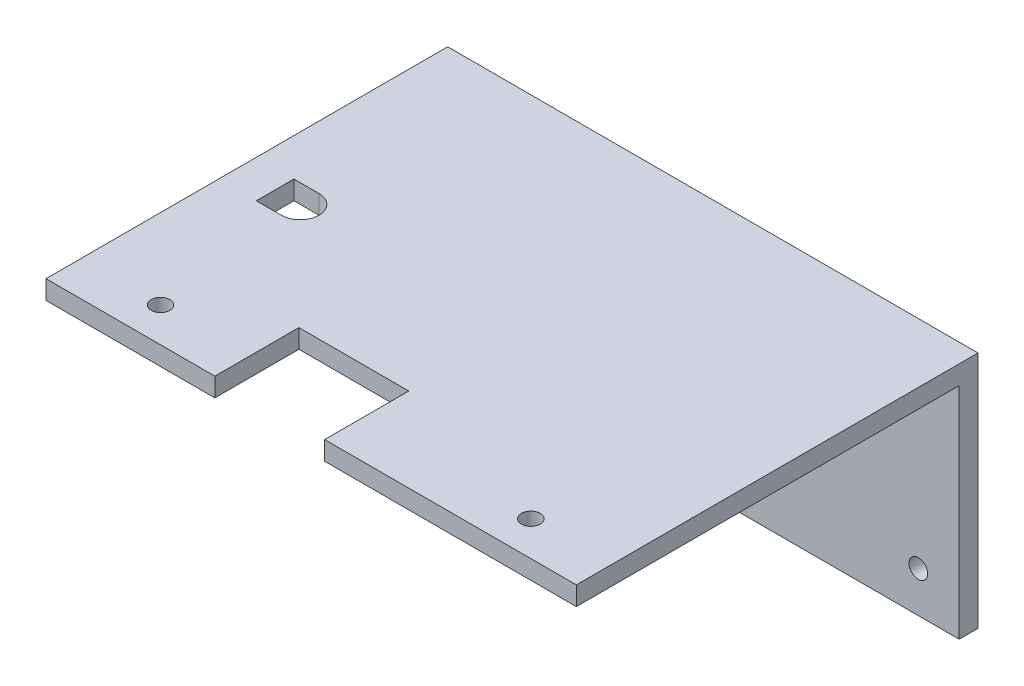
from build123d import *
from build123d.topology import SkipClean

# Parameters (mm, degrees)
SKETCH_1_R           = 1.52
EXTRUDE_2_DEPTH      = 3
SKETCH_2_W           = 84.5
SKETCH_2_H           = 3
EXTRUDE_3_DEPTH      = 58
SKETCH_3_W           = 3
SKETCH_3_H           = 32
EXTRUDE_4_DEPTH      = 58
SKETCH_5_R           = 2.1
CUT_EXTRUDE_1_DEPTH  = 58
EXTRUDE_9_DEPTH      = 5
CUT_EXTRUDE_4_DEPTH  = 4
SKETCH_15_W          = 7
SKETCH_15_H          = 7
EXTRUDE_10_DEPTH     = 7
CUT_EXTRUDE_5_DEPTH  = 5
EXTRUDE_11_DEPTH     = 84.5
CUT_EXTRUDE_START    = 84.5
SKETCH_19_R          = 1.49
CUT_EXTRUDE_6_DEPTH  = 84.5
CUT_EXTRUDE_START_2  = -84.5
SKETCH_20_R          = 1.49
CUT_EXTRUDE_7_DEPTH  = 84.5
SKETCH_21_W          = 61
SKETCH_21_H          = 35
CUT_EXTRUDE_8_DEPTH  = 84.5
SKETCH_22_W          = 34.5
SKETCH_22_H          = 10
CUT_EXTRUDE_9_DEPTH  = 1.5
CUT_EXTRUDE_10_DEPTH = 3
CUT_EXTRUDE_11_DEPTH = 3
SKETCH_27_W          = 1
SKETCH_27_H          = 6
CUT_EXTRUDE_12_DEPTH = 10
SKETCH_26_W          = 8.683127207
SKETCH_26_H          = 1.477167277
SKETCH_26_H_2        = 1.477167278
CUT_EXTRUDE_13_DEPTH = 1


with BuildPart() as part:
    # 草图1 → 凸台-拉伸2 (new body)
    with BuildSketch(Plane.XY):
        Polygon((0, 0), (42.25, 0), (42.25, 35), (0, 35), (-42.25, 35), (-42.25, 0), align=None)
        with Locations((-29.5, 17)):
            Circle(SKETCH_1_R, mode=Mode.SUBTRACT)
        with Locations((29.5, 17)):
            Circle(SKETCH_1_R, mode=Mode.SUBTRACT)
    extrude(amount=EXTRUDE_2_DEPTH)

    # 草图2 → 凸台-拉伸3 (add)
    with BuildSketch(Plane(origin=(0, 0, 0), x_dir=(-1, 0, 0), z_dir=(0, 0, -1))):
        with Locations((0, 1.5)):
            Rectangle(SKETCH_2_W, SKETCH_2_H)
    extrude(amount=EXTRUDE_3_DEPTH)

    # 草图3 → 凸台-拉伸4 (add)
    with BuildSketch(Plane(origin=(0, 0, 0), x_dir=(-1, 0, 0), z_dir=(0, 0, -1))):
        with Locations((40.75, 19)):
            Rectangle(SKETCH_3_W, SKETCH_3_H)
        with Locations((-40.75, 19)):
            Rectangle(SKETCH_3_W, SKETCH_3_H)
    extrude(amount=EXTRUDE_4_DEPTH)

    # 草图5 → 切除-拉伸1 (cut)
    with BuildSketch(Plane(origin=(42.25, 0, 0), x_dir=(0, 0, -1), z_dir=(1, 0, 0))):
        with Locations((16, 17)):
            Circle(SKETCH_5_R)
    extrude(amount=-CUT_EXTRUDE_1_DEPTH, mode=Mode.SUBTRACT)

    # 草图12 → 凸台-拉伸9 (add)
    with BuildSketch(Plane(origin=(0, 0, 0), x_dir=(-1, 0, 0), z_dir=(0, 0, -1))):
        Polygon((-35, 28), (-35, 35), (-24, 35), (-24, 28), (-29.5, 28), align=None)
        Polygon((29.5, 28), (24, 28), (24, 35), (35, 35), (35, 28), align=None)
    extrude(amount=EXTRUDE_9_DEPTH)

    # 草图14 → 切除-拉伸4 (cut)
    with BuildSketch(Plane(origin=(0, 35, 0), x_dir=(1, 0, 0), z_dir=(0, 1, 0))):
        with BuildLine():
            ThreePointArc((-28.01, 2.5), (-29.184567453, 3.956228797), (-30.856446051, 3.116566387))
            Line((-30.856446051, 3.116566387), (-28.143553949, 1.883433613))
            ThreePointArc((-28.143553949, 1.883433613), (-28.043771203, 2.184567453), (-28.01, 2.5))
        make_face()
        with BuildLine():
            Line((-28.143553949, 1.883433613), (-30.856446051, 3.116566387))
            ThreePointArc((-30.856446051, 3.116566387), (-30.116566387, 1.143553949), (-28.143553949, 1.883433613))
        make_face()
        with BuildLine():
            ThreePointArc((30.99, 2.5), (29.815432547, 3.956228797), (28.143553949, 3.116566387))
            Line((28.143553949, 3.116566387), (30.856446051, 1.883433613))
            ThreePointArc((30.856446051, 1.883433613), (30.956228797, 2.184567453), (30.99, 2.5))
        make_face()
        with BuildLine():
            Line((30.856446051, 1.883433613), (28.143553949, 3.116566387))
            ThreePointArc((28.143553949, 3.116566387), (28.883433613, 1.143553949), (30.856446051, 1.883433613))
        make_face()
    extrude(amount=-CUT_EXTRUDE_4_DEPTH, mode=Mode.SUBTRACT)

    # 草图15 → 凸台-拉伸10 (add)
    with BuildSketch(Plane(origin=(0, 3, 0), x_dir=(1, 0, 0), z_dir=(0, 1, 0))):
        with Locations((35.75, 54.5)):
            Rectangle(SKETCH_15_W, SKETCH_15_H)
        with Locations((-35.75, 54.5)):
            Rectangle(SKETCH_15_W, SKETCH_15_H)
    extrude(amount=EXTRUDE_10_DEPTH)

    # 草图16 → 切除-拉伸5 (cut)
    with BuildSketch(Plane(origin=(0, 0, -58), x_dir=(-1, 0, 0), z_dir=(0, 0, -1))):
        with BuildLine():
            ThreePointArc((-34.26, 6.5), (-35.179801686, 7.876580503), (-36.803589104, 7.553589104))
            Line((-36.803589104, 7.553589104), (-34.696410896, 5.446410896))
            ThreePointArc((-34.696410896, 5.446410896), (-34.373419497, 5.929801686), (-34.26, 6.5))
        make_face()
        with BuildLine():
            Line((-34.696410896, 5.446410896), (-36.803589104, 7.553589104))
            ThreePointArc((-36.803589104, 7.553589104), (-36.803589104, 5.446410896), (-34.696410896, 5.446410896))
        make_face()
        with BuildLine():
            ThreePointArc((36.803589104, 7.553589104), (34.696410896, 7.553589104), (34.696410896, 5.446410896))
            Line((34.696410896, 5.446410896), (36.803589104, 7.553589104))
        make_face()
        with BuildLine():
            Line((36.803589104, 7.553589104), (34.696410896, 5.446410896))
            ThreePointArc((34.696410896, 5.446410896), (36.320198314, 5.123419497), (37.24, 6.5))
            ThreePointArc((37.24, 6.5), (37.126580503, 7.070198314), (36.803589104, 7.553589104))
        make_face()
    extrude(amount=-CUT_EXTRUDE_5_DEPTH, mode=Mode.SUBTRACT)

    # 草图17 → 凸台-拉伸11 (add)
    with BuildSketch(Plane(origin=(42.25, 0, 0), x_dir=(0, 0, -1), z_dir=(1, 0, 0))):
        Polygon((58, 35), (58, 0), (61, 0), (61, 38), (58, 38), (-3, 38), (-3, 35), align=None)
    extrude(amount=-EXTRUDE_11_DEPTH)

    # 草图19 → 切除-拉伸6 (cut)
    with SkipClean():  # the faces are left unmerged after this step: merging them gives an invalid solid
        with BuildSketch(Plane(origin=(0, 0, 0), x_dir=(-1, 0, 0), z_dir=(0, 0, -1)).offset(CUT_EXTRUDE_START)):
            with Locations((-35.75, 6.5)):
                Circle(SKETCH_19_R)
            with Locations((35.75, 6.5)):
                Circle(SKETCH_19_R)
        extrude(amount=-CUT_EXTRUDE_6_DEPTH, mode=Mode.SUBTRACT)

    # 草图20 → 切除-拉伸7 (cut)
    with SkipClean():  # the faces are left unmerged after this step: merging them gives an invalid solid
        with BuildSketch(Plane.XZ.offset(-28).offset(CUT_EXTRUDE_START_2)):
            with Locations(Location((-29.5, -2.5, 0), (0, 0, 270))):
                Circle(SKETCH_20_R)
            with Locations(Location((29.5, -2.5, 0), (0, 0, 270))):
                Circle(SKETCH_20_R)
        extrude(amount=CUT_EXTRUDE_7_DEPTH, mode=Mode.SUBTRACT)

    # 草图21 → 切除-拉伸8 (cut)
    with BuildSketch(Plane.ZY.offset(42.25)):
        with Locations((-27.5, 17.5)):
            Rectangle(SKETCH_21_W, SKETCH_21_H)
    extrude(amount=-CUT_EXTRUDE_8_DEPTH, mode=Mode.SUBTRACT)

    # 草图22 → 切除-拉伸9 (cut)
    with BuildSketch(Plane.XZ.offset(-35)):
        with Locations((0, -53)):
            Rectangle(SKETCH_22_W, SKETCH_22_H)
    extrude(amount=-CUT_EXTRUDE_9_DEPTH, mode=Mode.SUBTRACT)

    # 草图23 → 切除-拉伸10 (cut)
    with BuildSketch(Plane(origin=(0, 38, 0), x_dir=(1, 0, 0), z_dir=(0, 1, 0))):
        with BuildLine():
            Line((-32.25, 24.5), (-35.25, 24.5))
            Line((-35.25, 24.5), (-35.25, 27.5))
            Line((-35.25, 27.5), (-35.25, 30.5))
            Line((-35.25, 30.5), (-32.25, 30.5))
            ThreePointArc((-32.25, 30.5), (-29.25, 27.5), (-32.25, 24.5))
        make_face()
    extrude(amount=-CUT_EXTRUDE_10_DEPTH, mode=Mode.SUBTRACT)

    # 草图24 → 切除-拉伸11 (cut)
    with BuildSketch(Plane(origin=(0, 38, 0), x_dir=(1, 0, 0), z_dir=(0, 1, 0))):
        Polygon((2.15, -3), (2.15, 10.4), (-15.35, 10.4), (-15.35, -3), (-12.699197399, -3), (-12.199197399, -3), (-1.699197399, -3), align=None)
    extrude(amount=-CUT_EXTRUDE_11_DEPTH, mode=Mode.SUBTRACT)

    # 草图27 → 切除-拉伸12 (cut)
    with BuildSketch(Plane(origin=(0, 38, 0), x_dir=(1, 0, 0), z_dir=(0, 1, 0))):
        with Locations((-35.75, 27.5)):
            Rectangle(SKETCH_27_W, SKETCH_27_H)
    extrude(amount=-CUT_EXTRUDE_12_DEPTH, mode=Mode.SUBTRACT)

    # 草图26 → 切除-拉伸13 (cut)
    # profile 1 of 9: a face of its own
    with BuildSketch(Plane(origin=(0, 0, -61), x_dir=(-1, 0, 0), z_dir=(0, 0, -1))):
        with BuildLine():
            Line((-24.160270124, 21.995809621), (-24.160270124, 18.425534467))
            Line((-24.160270124, 18.425534467), (-12.680881613, 18.425534467))
            Line((-12.680881613, 18.425534467), (-11.724265904, 19.382150176))
            Line((-11.724265904, 19.382150176), (-10.326135252, 17.984019524))
            Line((-10.326135252, 17.984019524), (-14.226183913, 17.984019524))
            Line((-14.226183913, 17.984019524), (-13.269568203, 17.248161286))
            add(Edge.make_bspline(
                [(-13.269568203, 17.248161286), (-13.379027332, 17.209369794), (-13.596665008, 17.132240637), (-13.915197945, 16.995553485), (-14.222085774, 16.835916879), (-14.476059594, 16.689989672), (-14.683649855, 16.554382392), (-14.858077056, 16.434366022), (-15.050535543, 16.294785422), (-15.263725048, 16.140549276), (-15.492584267, 15.964754759), (-15.740770406, 15.771458002), (-16.006974396, 15.558655054), (-16.191204175, 15.411248091), (-16.286586979, 15.334929868)],
                knots=[0, 0, 0, 0, 1.162989737, 2.312373436, 3.468114612, 4.626110198, 5.24445396, 5.951151674, 6.746590043, 7.625640194, 8.586542864, 9.636780879, 10.776471069, 12, 12, 12, 12], degree=3))
            add(Edge.make_bspline(
                [(-16.286586979, 15.334929868), (-16.197151874, 15.274208687), (-16.014644176, 15.150296685), (-15.724632123, 14.974581485), (-15.410838022, 14.810775679), (-15.077660251, 14.64781088), (-14.721220459, 14.497095385), (-14.343031309, 14.351802315), (-13.943488451, 14.214331806), (-13.388869683, 14.036648471), (-12.689222869, 13.850898979), (-11.85710786, 13.689369841), (-11.047179402, 13.589306553), (-10.514454291, 13.57560582), (-10.252549428, 13.568870097)],
                knots=[0, 0, 0, 0, 0.611010418, 1.246871733, 1.915364327, 2.611282961, 3.342891768, 4.102025923, 4.90105097, 5.730948828, 7.393839832, 8.989131719, 10.519759946, 12, 12, 12, 12], degree=3))
            Line((-10.252549428, 13.568870097), (-10.252549428, 13.274526802))
            add(Edge.make_bspline(
                [(-10.252549428, 13.274526802), (-10.34657537, 13.2544835), (-10.52578858, 13.216281017), (-10.777041509, 13.133548249), (-10.998941308, 13.034712148), (-11.190400303, 12.912864051), (-11.352373959, 12.773622454), (-11.486525492, 12.61694506), (-11.586706503, 12.438471321), (-11.629148565, 12.309668786), (-11.65068008, 12.244325269)],
                knots=[0, 0, 0, 0, 1.255284546, 2.392569207, 3.449534634, 4.420859121, 5.346510379, 6.230990395, 7.102554087, 8, 8, 8, 8], degree=3))
            add(Edge.make_bspline(
                [(-11.65068008, 12.244325269), (-11.822789276, 12.283602514), (-12.167080606, 12.362173649), (-12.678225983, 12.509507779), (-13.188934204, 12.673286475), (-13.694305529, 12.869609543), (-14.200888823, 13.081348205), (-14.703514872, 13.318220227), (-15.203939479, 13.57910278), (-15.704196457, 13.859472048), (-16.197678133, 14.181192886), (-16.670438244, 14.561686751), (-17.128330747, 14.995970149), (-17.569461211, 15.484201867), (-17.992593792, 16.030446075), (-18.399477087, 16.630330395), (-18.794927657, 17.28326736), (-19.033803799, 17.746310202), (-19.156434107, 17.984019524)],
                knots=[0, 0, 0, 0, 0.861892958, 1.724151182, 2.596755242, 3.479973936, 4.370648144, 5.27758037, 6.192291257, 7.126070541, 8.077182181, 9.065156301, 10.08504478, 11.156061535, 12.275074646, 13.456322362, 14.694168589, 16, 16, 16, 16], degree=3))
            Line((-19.156434107, 17.984019524), (-21.069665525, 17.984019524))
            Line((-21.069665525, 17.984019524), (-21.069665525, 13.623378114))
            Line((-21.069665525, 13.623378114), (-17.390374336, 14.585444626))
            Line((-17.390374336, 14.585444626), (-17.316788512, 14.364687154))
            add(Edge.make_bspline(
                [(-17.316788512, 14.364687154), (-17.45772383, 14.301364875), (-17.732876029, 14.177738914), (-18.13348163, 13.992297401), (-18.512439288, 13.812634926), (-18.870147572, 13.637687994), (-19.206242779, 13.469525315), (-19.522395551, 13.308589323), (-19.814833454, 13.150378941), (-20.088641126, 13.000210705), (-20.341383729, 12.857521368), (-20.571311378, 12.717000033), (-20.780988349, 12.584485214), (-20.969514912, 12.456785951), (-21.134959988, 12.333805343), (-21.281895424, 12.220221873), (-21.403870271, 12.108022185), (-21.476926727, 12.033826892), (-21.511180468, 11.999039189)],
                knots=[0, 0, 0, 0, 1.533553566, 2.994002063, 4.381478458, 5.696137863, 6.946221177, 8.111684215, 9.217067415, 10.246152141, 11.211350723, 12.097452041, 12.920423487, 13.673221831, 14.356732153, 14.966497679, 15.51542516, 16, 16, 16, 16], degree=3))
            Line((-21.511180468, 11.999039189), (-22.32062453, 13.181863172))
            add(Edge.make_bspline(
                [(-22.32062453, 13.181863172), (-22.297072958, 13.202885592), (-22.248239096, 13.246475294), (-22.18824227, 13.331195768), (-22.136013315, 13.432726717), (-22.096724402, 13.554532436), (-22.06343145, 13.693786683), (-22.043585697, 13.851867027), (-22.029493323, 14.027392321), (-22.027387403, 14.150254669), (-22.026281234, 14.214790106)],
                knots=[0, 0, 0, 0, 0.682693637, 1.415555963, 2.234920952, 3.150681089, 4.182789996, 5.336176214, 6.600783439, 8, 8, 8, 8], degree=3))
            Line((-22.026281234, 14.214790106), (-22.026281234, 17.984019524))
            Line((-22.026281234, 17.984019524), (-24.160270124, 17.984019524))
            add(Edge.make_bspline(
                [(-24.160270124, 17.984019524), (-24.168125469, 17.786820008), (-24.18341644, 17.40295756), (-24.225995993, 16.845483091), (-24.28909383, 16.322812005), (-24.36771653, 15.834473788), (-24.461258923, 15.378984353), (-24.575892362, 14.958706334), (-24.706030394, 14.573318562), (-24.854644006, 14.217160973), (-25.030991723, 13.882708525), (-25.228774831, 13.555763946), (-25.457464537, 13.235029228), (-25.714546505, 12.918677558), (-26.000641454, 12.605065239), (-26.317753786, 12.298121792), (-26.661021037, 11.994556213), (-26.905567736, 11.802507686), (-27.030117252, 11.704695894)],
                knots=[0, 0, 0, 0, 1.314456064, 2.558679314, 3.722765753, 4.820013758, 5.852481819, 6.818366769, 7.719637783, 8.560266732, 9.385732132, 10.235652473, 11.10366755, 12.007109401, 12.949392841, 13.929296627, 14.94537484, 16, 16, 16, 16], degree=3))
            Line((-27.030117252, 11.704695894), (-27.250874723, 11.925453366))
            add(Edge.make_bspline(
                [(-27.250874723, 11.925453366), (-27.144030867, 12.030338658), (-26.932379786, 12.238109945), (-26.643447224, 12.57143052), (-26.383166481, 12.919457311), (-26.151098684, 13.280287452), (-25.952522548, 13.657483066), (-25.77576383, 14.04470512), (-25.631915178, 14.447970951), (-25.480240864, 15.009127767), (-25.33606624, 15.739335242), (-25.206759093, 16.649043681), (-25.131118944, 17.600205793), (-25.111825957, 18.59535819), (-25.1222814, 19.63927197), (-25.134968278, 20.739454035), (-25.15623546, 21.899633602), (-25.178860218, 22.692621218), (-25.190471657, 23.099596978)],
                knots=[0, 0, 0, 0, 0.612753261, 1.213826364, 1.803679967, 2.390712863, 2.968052278, 3.54732904, 4.131989122, 4.718479832, 5.92561504, 7.176358299, 8.478503378, 9.828960425, 11.249685427, 12.752326763, 14.333234648, 16, 16, 16, 16], degree=3))
            Line((-25.190471657, 23.099596978), (-23.939512653, 22.437324564))
            Line((-23.939512653, 22.437324564), (-13.343154027, 22.437324564))
            Line((-13.343154027, 22.437324564), (-12.460124142, 23.32035445))
            Line((-12.460124142, 23.32035445), (-11.135579313, 21.995809621))
            Line((-11.135579313, 21.995809621), (-24.160270124, 21.995809621))
        make_face()
        with BuildLine():
            add(Edge.make_bspline(
                [(-18.714919164, 17.984019524), (-18.629800887, 17.852388691), (-18.463350906, 17.594982758), (-18.198748129, 17.230394042), (-17.939824425, 16.884933279), (-17.672240606, 16.570027342), (-17.403650909, 16.279402591), (-17.13532419, 16.011956537), (-16.862384998, 15.770524293), (-16.673549422, 15.626384379), (-16.580930274, 15.555687339)],
                knots=[0, 0, 0, 0, 1.157122963, 2.262770124, 3.325256553, 4.343813707, 5.312101841, 6.246458264, 7.139931436, 8, 8, 8, 8], degree=3))
            add(Edge.make_bspline(
                [(-16.580930274, 15.555687339), (-16.479859653, 15.66994998), (-16.281905757, 15.893741369), (-15.99552218, 16.225353342), (-15.729494482, 16.546980047), (-15.479117259, 16.854988538), (-15.252032181, 17.15519431), (-15.039148932, 17.440481364), (-14.843317304, 17.713407529), (-14.7251781, 17.895449256), (-14.667698855, 17.984019524)],
                knots=[0, 0, 0, 0, 1.183140506, 2.317263606, 3.398018913, 4.420277862, 5.395463474, 6.317073486, 7.181191834, 8, 8, 8, 8], degree=3))
            Line((-14.667698855, 17.984019524), (-18.714919164, 17.984019524))
        make_face(mode=Mode.SUBTRACT)
    # profile 2 of 9: a face of its own
    with BuildSketch(Plane(origin=(0, 0, -61), x_dir=(-1, 0, 0), z_dir=(0, 0, -1))):
        with BuildLine():
            Line((-23.277240239, 20.518642344), (-14.888456327, 20.518642344))
            Line((-14.888456327, 20.518642344), (-14.079012265, 21.328086405))
            Line((-14.079012265, 21.328086405), (-12.828053261, 20.077127401))
            Line((-12.828053261, 20.077127401), (-20.848908054, 20.077127401))
            add(Edge.make_bspline(
                [(-20.848908054, 20.077127401), (-21.023427242, 20.074769381), (-21.354826742, 20.070291668), (-21.824906807, 20.030300409), (-22.24134465, 19.962778759), (-22.495569603, 19.890374847), (-22.614967825, 19.85636993)],
                knots=[0, 0, 0, 0, 1.172045317, 2.22563053, 3.166657104, 4, 4, 4, 4], degree=3))
            Line((-22.614967825, 19.85636993), (-23.277240239, 20.518642344))
        make_face()
    # profile 3 of 9: a face of its own
    with BuildSketch(Plane(origin=(0, 0, -61), x_dir=(-1, 0, 0), z_dir=(0, 0, -1))):
        with BuildLine():
            add(Edge.make_bspline(
                [(-23.865926829, 23.031461956), (-23.845291812, 23.497427428), (-23.803995333, 24.429955543), (-23.786395113, 25.837721456), (-23.804610344, 27.264521037), (-23.845329615, 28.223425163), (-23.865926829, 28.708471992)],
                knots=[0, 0, 0, 0, 0.985459739, 1.972182419, 2.974259824, 4, 4, 4, 4], degree=3))
            Line((-23.865926829, 28.708471992), (-22.762139472, 28.193371225))
            Line((-22.762139472, 28.193371225), (-14.299769736, 28.193371225))
            Line((-14.299769736, 28.193371225), (-13.637497322, 28.972835877))
            Line((-13.637497322, 28.972835877), (-12.460124142, 28.005318564))
            Line((-12.460124142, 28.005318564), (-13.195982379, 27.484766996))
            add(Edge.make_bspline(
                [(-13.195982379, 27.484766996), (-13.196552469, 27.242203997), (-13.197637152, 26.780690827), (-13.190359125, 26.12297442), (-13.186012185, 25.53517872), (-13.178427759, 25.017317055), (-13.166172803, 24.569499049), (-13.15794357, 24.191392115), (-13.140867137, 23.882560256), (-13.12802282, 23.700080927), (-13.122396556, 23.620148546)],
                knots=[0, 0, 0, 0, 1.505804279, 2.865022734, 4.083253695, 5.154933375, 6.080121932, 6.864367033, 7.502552716, 8, 8, 8, 8], degree=3))
            Line((-13.122396556, 23.620148546), (-14.152598089, 23.178633604))
            Line((-14.152598089, 23.178633604), (-14.152598089, 23.914491842))
            Line((-14.152598089, 23.914491842), (-22.835725296, 23.914491842))
            Line((-22.835725296, 23.914491842), (-22.835725296, 23.472976899))
            Line((-22.835725296, 23.472976899), (-23.865926829, 23.031461956))
        make_face()
        with Locations((-18.494161693, 27.013272644)):
            Rectangle(SKETCH_26_W, SKETCH_26_H, mode=Mode.SUBTRACT)
        with Locations((-18.494161693, 25.094590423)):
            Rectangle(SKETCH_26_W, SKETCH_26_H_2, mode=Mode.SUBTRACT)
    # profile 4 of 9: a face of its own
    with BuildSketch(Plane(origin=(0, 0, -61), x_dir=(-1, 0, 0), z_dir=(0, 0, -1))):
        with BuildLine():
            Line((-3.11472452, 26.100263348), (5.936331806, 26.100263348))
            Line((5.936331806, 26.100263348), (6.819361692, 26.983293234))
            Line((6.819361692, 26.983293234), (8.070320696, 25.658748406))
            Line((8.070320696, 25.658748406), (2.698555559, 25.658748406))
            Line((2.698555559, 25.658748406), (2.698555559, 14.064893057))
            Line((2.698555559, 14.064893057), (6.525018396, 14.064893057))
            Line((6.525018396, 14.064893057), (7.555219929, 15.09509459))
            Line((7.555219929, 15.09509459), (8.953350582, 13.623378114))
            Line((8.953350582, 13.623378114), (-2.52603793, 13.623378114))
            add(Edge.make_bspline(
                [(-2.52603793, 13.623378114), (-2.682383893, 13.620825327), (-2.989267799, 13.615814583), (-3.441008131, 13.574448482), (-3.874454144, 13.504533239), (-4.154394078, 13.436222822), (-4.292097701, 13.402620643)],
                knots=[0, 0, 0, 0, 1.051078301, 2.063110603, 3.047236021, 4, 4, 4, 4], degree=3))
            Line((-4.292097701, 13.402620643), (-4.954370115, 14.064893057))
            Line((-4.954370115, 14.064893057), (1.594768202, 14.064893057))
            Line((1.594768202, 14.064893057), (1.594768202, 25.658748406))
            Line((1.594768202, 25.658748406), (-0.686392335, 25.658748406))
            add(Edge.make_bspline(
                [(-0.686392335, 25.658748406), (-0.842738298, 25.656195618), (-1.149622204, 25.651184875), (-1.601362537, 25.609818773), (-2.034808549, 25.53990353), (-2.314748484, 25.471593113), (-2.452452106, 25.437990934)],
                knots=[0, 0, 0, 0, 1.051078301, 2.063110603, 3.047236021, 4, 4, 4, 4], degree=3))
            Line((-2.452452106, 25.437990934), (-3.11472452, 26.100263348))
        make_face()
    # profile 5 of 9: a face of its own
    with BuildSketch(Plane(origin=(0, 0, -61), x_dir=(-1, 0, 0), z_dir=(0, 0, -1))):
        with BuildLine():
            add(Edge.make_bspline(
                [(-2.746795401, 25.260839877), (-2.839427742, 24.968303609), (-3.019228084, 24.400487655), (-3.281770497, 23.573160017), (-3.527043669, 22.794598215), (-3.754082435, 22.064217083), (-3.972625716, 21.385363248), (-4.165610723, 20.753301375), (-4.350978515, 20.172123361), (-4.514359328, 19.638579496), (-4.670374497, 19.155992268), (-4.800873926, 18.720234098), (-4.922835497, 18.335051048), (-5.025763944, 17.998715596), (-5.111856354, 17.711027089), (-5.188487564, 17.474461926), (-5.240136864, 17.284120702), (-5.322152673, 17.016183331), (-5.404782941, 16.630321005), (-5.477784944, 16.093729016), (-5.515026362, 15.506310117), (-5.512882869, 14.991341314), (-5.497009, 14.575442518), (-5.486138402, 14.282003485), (-5.475961421, 14.013933617), (-5.463169302, 13.771269416), (-5.444603416, 13.554423358), (-5.433080067, 13.362441289), (-5.417079938, 13.195128646), (-5.402574937, 13.092792004), (-5.395885058, 13.045593128)],
                knots=[0, 0, 0, 0, 2.041568967, 3.962706699, 5.774940625, 7.472509966, 9.051465666, 10.519714011, 11.86933399, 13.110059976, 14.232164243, 15.243582626, 16.136356738, 16.920250246, 17.583717625, 18.134310754, 18.574340471, 18.895654842, 19.998366152, 21.194231333, 22.496502179, 23.910862062, 24.618455167, 25.265644129, 25.864515384, 26.403303927, 26.882176691, 27.312382891, 27.682862807, 28, 28, 28, 28], degree=3))
            add(Edge.make_bspline(
                [(-5.395885058, 13.045593128), (-5.398665305, 13.001483546), (-5.403941562, 12.917773893), (-5.485344353, 12.814119132), (-5.61297447, 12.758901961), (-5.70961306, 12.753999466), (-5.763814177, 12.751249832)],
                knots=[0, 0, 0, 0, 0.970945968, 1.84262797, 2.790007448, 4, 4, 4, 4], degree=3))
            add(Edge.make_bspline(
                [(-5.763814177, 12.751249832), (-5.815746821, 12.752578259), (-5.92676303, 12.755418032), (-6.100714255, 12.790526499), (-6.29568396, 12.832149852), (-6.498223238, 12.893744246), (-6.697020507, 12.97809308), (-6.839919706, 13.134548928), (-6.930080506, 13.333055355), (-6.937322348, 13.481479276), (-6.941187357, 13.560693894)],
                knots=[0, 0, 0, 0, 0.773098138, 1.652648856, 2.638415398, 3.7437562, 4.81590307, 5.802785575, 6.827335235, 8, 8, 8, 8], degree=3))
            add(Edge.make_bspline(
                [(-6.941187357, 13.560693894), (-6.937934221, 13.629862536), (-6.930657525, 13.784580687), (-6.886515389, 14.037950208), (-6.81305059, 14.336110537), (-6.752921142, 14.549289114), (-6.720429886, 14.664481251)],
                knots=[0, 0, 0, 0, 0.735604743, 1.64541913, 2.727690164, 4, 4, 4, 4], degree=3))
            add(Edge.make_bspline(
                [(-6.720429886, 14.664481251), (-6.687637367, 14.780506109), (-6.625708814, 14.999618637), (-6.55354849, 15.311907658), (-6.509346052, 15.5889468), (-6.502735197, 15.761781027), (-6.499672415, 15.841854432)],
                knots=[0, 0, 0, 0, 1.204024663, 2.273796248, 3.200256724, 4, 4, 4, 4], degree=3))
            add(Edge.make_bspline(
                [(-6.499672415, 15.841854432), (-6.504150102, 15.922992722), (-6.512785333, 16.079468099), (-6.570839154, 16.303273162), (-6.682009733, 16.494647268), (-6.804709832, 16.634283399), (-6.931456415, 16.729800377), (-7.050403392, 16.804574355), (-7.194660677, 16.875945376), (-7.361771866, 16.950103255), (-7.553015164, 17.023095953), (-7.768561306, 17.096352524), (-8.008530152, 17.169906593), (-8.177474069, 17.215937857), (-8.265732186, 17.239985084)],
                knots=[0, 0, 0, 0, 1.187079274, 2.289285076, 3.342195022, 4.395775184, 4.983000191, 5.657502931, 6.447674094, 7.333854754, 8.330539672, 9.439608888, 10.662424192, 12, 12, 12, 12], degree=3))
            Line((-8.265732186, 17.239985084), (-8.265732186, 17.534328379))
            add(Edge.make_bspline(
                [(-8.265732186, 17.534328379), (-8.160328969, 17.523637591), (-7.960403619, 17.503359656), (-7.676435167, 17.471289125), (-7.422778883, 17.45033409), (-7.200207631, 17.433635135), (-7.008518025, 17.422489049), (-6.848544438, 17.416357096), (-6.719530612, 17.416589775), (-6.583737884, 17.419797532), (-6.421119619, 17.473358788), (-6.241835116, 17.615378198), (-6.053701429, 17.821637831), (-5.913216166, 18.021581654), (-5.8054173, 18.199005326), (-5.735073123, 18.350406292), (-5.644554074, 18.546316004), (-5.53903957, 18.789284173), (-5.415940564, 19.077614916), (-5.280531391, 19.41359573), (-5.128076721, 19.7964816), (-4.954971702, 20.224577143), (-4.774873911, 20.703560202), (-4.572039346, 21.226037823), (-4.353169902, 21.795902685), (-4.123579225, 22.413876071), (-3.873950238, 23.077360297), (-3.610661094, 23.788182829), (-3.329128286, 24.545209147), (-3.13897058, 25.06632385), (-3.041138696, 25.334425701)],
                knots=[0, 0, 0, 0, 0.850511031, 1.613221316, 2.293981825, 2.893612504, 3.404960353, 3.835498749, 4.178273129, 4.441228577, 4.923289046, 5.518468063, 6.256366938, 7.160972486, 7.474913609, 7.921759358, 8.499387229, 9.208054695, 10.047898715, 11.01623083, 12.11591387, 13.356443752, 14.723072805, 16.223745304, 17.855846161, 19.623630231, 21.516038356, 23.546736579, 25.708895644, 28, 28, 28, 28], degree=3))
            Line((-3.041138696, 25.334425701), (-2.746795401, 25.260839877))
        make_face()
    # profile 6 of 9: a face of its own
    with BuildSketch(Plane(origin=(0, 0, -61), x_dir=(-1, 0, 0), z_dir=(0, 0, -1))):
        with BuildLine():
            add(Edge.make_bspline(
                [(-8.192146362, 24.18703193), (-7.990458264, 24.082442082), (-7.609488991, 23.884881993), (-7.085120965, 23.580048878), (-6.640249475, 23.290140937), (-6.273549219, 23.016913782), (-5.989354573, 22.755216585), (-5.780545077, 22.510701799), (-5.649105382, 22.274348234), (-5.608677547, 22.046105237), (-5.620640749, 21.843659912), (-5.637321799, 21.659369853), (-5.670886607, 21.492738895), (-5.713196869, 21.341351145), (-5.770550356, 21.206455469), (-5.841037404, 21.088821987), (-5.924399384, 20.988277214), (-6.016319304, 20.907988017), (-6.113801431, 20.852700054), (-6.217230833, 20.834503262), (-6.318251357, 20.870323124), (-6.407834703, 20.949390318), (-6.492533202, 21.06559359), (-6.573476368, 21.221191628), (-6.651138408, 21.417970077), (-6.69611105, 21.564822727), (-6.720429886, 21.644232908)],
                knots=[0, 0, 0, 0, 2.772682241, 5.237328091, 7.399302354, 9.251042932, 10.812257102, 12.104195485, 13.165469004, 14.067972364, 14.88878903, 15.635733183, 16.325068669, 16.960193367, 17.551302845, 18.108471374, 18.628074858, 19.139209544, 19.590563383, 19.982585792, 20.378819423, 20.851592597, 21.421523614, 22.125943269, 22.986608804, 24, 24, 24, 24], degree=3))
            add(Edge.make_bspline(
                [(-6.720429886, 21.644232908), (-6.754692027, 21.725633644), (-6.826331448, 21.895836131), (-6.962985711, 22.15202586), (-7.1224653, 22.423959702), (-7.312533644, 22.707458694), (-7.527781971, 23.005609368), (-7.77437751, 23.314120193), (-8.043614675, 23.640673331), (-8.238528373, 23.8570907), (-8.339318009, 23.968999859)],
                knots=[0, 0, 0, 0, 0.744234975, 1.556136334, 2.445417578, 3.401334143, 4.432387501, 5.544831445, 6.73043532, 8, 8, 8, 8], degree=3))
            Line((-8.339318009, 23.968999859), (-8.192146362, 24.18703193))
        make_face()
    # profile 7 of 9: a face of its own
    with BuildSketch(Plane(origin=(0, 0, -61), x_dir=(-1, 0, 0), z_dir=(0, 0, -1))):
        with BuildLine():
            add(Edge.make_bspline(
                [(-6.79401571, 28.100707595), (-6.632063735, 28.017611014), (-6.325809687, 27.860473909), (-5.89643433, 27.630939955), (-5.528079346, 27.412292803), (-5.216705639, 27.21241532), (-4.963703519, 27.028480115), (-4.770826681, 26.859371182), (-4.630311326, 26.708745994), (-4.531191889, 26.528379118), (-4.473434961, 26.329310248), (-4.413907563, 26.12728093), (-4.374184209, 25.96187578), (-4.368242246, 25.862388269), (-4.365683525, 25.819547058)],
                knots=[0, 0, 0, 0, 1.862745508, 3.522484708, 4.981331506, 6.244841051, 7.308391781, 8.177705717, 8.869471105, 9.402220716, 10.26654944, 10.981658618, 11.561482858, 12, 12, 12, 12], degree=3))
            add(Edge.make_bspline(
                [(-4.365683525, 25.819547058), (-4.368606295, 25.759186554), (-4.374376327, 25.640024937), (-4.427455916, 25.468042192), (-4.506316588, 25.302939384), (-4.61961111, 25.159654786), (-4.734657758, 25.034270722), (-4.842093079, 24.942096926), (-4.936558059, 24.878384517), (-5.000094781, 24.867641996), (-5.027955939, 24.862931348)],
                knots=[0, 0, 0, 0, 1.168549645, 2.306910249, 3.466110278, 4.700391274, 5.835606663, 6.761275426, 7.456813324, 8, 8, 8, 8], degree=3))
            add(Edge.make_bspline(
                [(-5.027955939, 24.862931348), (-5.046667189, 24.865119134), (-5.087261711, 24.869865589), (-5.142313682, 24.911921683), (-5.200670293, 24.968496461), (-5.252196571, 25.052750941), (-5.30917625, 25.155263506), (-5.360395728, 25.28381452), (-5.419418322, 25.432466356), (-5.45215575, 25.541251897), (-5.469470881, 25.598789586)],
                knots=[0, 0, 0, 0, 0.49729429, 1.078892339, 1.802996595, 2.682097007, 3.70758534, 4.952970961, 6.388397881, 8, 8, 8, 8], degree=3))
            add(Edge.make_bspline(
                [(-5.469470881, 25.598789586), (-5.503091639, 25.680945268), (-5.572727858, 25.851108334), (-5.699074433, 26.107896779), (-5.85095229, 26.374594396), (-6.020784695, 26.655567873), (-6.219865806, 26.944079625), (-6.437714332, 27.247513469), (-6.679046517, 27.562371405), (-6.852396589, 27.772381771), (-6.941187357, 27.879950124)],
                knots=[0, 0, 0, 0, 0.781420074, 1.618498341, 2.517382713, 3.483140729, 4.508098388, 5.602518008, 6.771997814, 8, 8, 8, 8], degree=3))
            Line((-6.941187357, 27.879950124), (-6.79401571, 28.100707595))
        make_face()
    # profile 8 of 9: a face of its own
    with BuildSketch(Plane(origin=(0, 0, -61), x_dir=(-1, 0, 0), z_dir=(0, 0, -1))):
        with BuildLine():
            Line((22.198798864, 26.182025375), (22.198798864, 24.783894723))
            Line((22.198798864, 24.783894723), (21.168597331, 24.34237978))
            Line((21.168597331, 24.34237978), (21.168597331, 26.182025375))
            Line((21.168597331, 26.182025375), (17.194962846, 26.182025375))
            Line((17.194962846, 26.182025375), (17.194962846, 24.489551428))
            Line((17.194962846, 24.489551428), (16.164761313, 24.121622309))
            Line((16.164761313, 24.121622309), (16.164761313, 26.182025375))
            Line((16.164761313, 26.182025375), (13.883600775, 26.182025375))
            add(Edge.make_bspline(
                [(13.883600775, 26.182025375), (13.727254812, 26.179472587), (13.420370907, 26.174461844), (12.968630574, 26.133095743), (12.535184562, 26.063180499), (12.255244627, 25.994870083), (12.117541005, 25.961267903)],
                knots=[0, 0, 0, 0, 1.051078301, 2.063110603, 3.047236021, 4, 4, 4, 4], degree=3))
            Line((12.117541005, 25.961267903), (11.45526859, 26.623540317))
            Line((11.45526859, 26.623540317), (16.164761313, 26.623540317))
            add(Edge.make_bspline(
                [(16.164761313, 26.623540317), (16.161158596, 27.00881598), (16.153830835, 27.792449088), (16.112291752, 28.575018936), (16.091175489, 28.972835877)],
                knots=[0, 0, 0, 0, 0.98330624, 2, 2, 2, 2], degree=3))
            Line((16.091175489, 28.972835877), (17.85723526, 28.215174432))
            Line((17.85723526, 28.215174432), (17.194962846, 27.68372126))
            Line((17.194962846, 27.68372126), (17.194962846, 26.623540317))
            Line((17.194962846, 26.623540317), (21.168597331, 26.623540317))
            add(Edge.make_bspline(
                [(21.168597331, 26.623540317), (21.164994614, 27.00881598), (21.157666853, 27.792449088), (21.11612777, 28.575018936), (21.095011507, 28.972835877)],
                knots=[0, 0, 0, 0, 0.98330624, 2, 2, 2, 2], degree=3))
            Line((21.095011507, 28.972835877), (22.861071278, 28.215174432))
            Line((22.861071278, 28.215174432), (22.198798864, 27.68372126))
            Line((22.198798864, 27.68372126), (22.198798864, 26.623540317))
            Line((22.198798864, 26.623540317), (23.964858635, 26.623540317))
            Line((23.964858635, 26.623540317), (25.215817639, 27.727327674))
            Line((25.215817639, 27.727327674), (26.687534115, 26.182025375))
            Line((26.687534115, 26.182025375), (22.198798864, 26.182025375))
        make_face()
    # profile 9 of 9: a face of its own
    with BuildSketch(Plane(origin=(0, 0, -61), x_dir=(-1, 0, 0), z_dir=(0, 0, -1))):
        with BuildLine():
            add(Edge.make_bspline(
                [(19.696880855, 17.460742555), (19.696320156, 17.154587388), (19.695246996, 16.568616851), (19.70252916, 15.730112811), (19.706872407, 14.972437344), (19.714575219, 14.295605442), (19.726757408, 13.699692327), (19.735098256, 13.184460578), (19.752492411, 12.750268869), (19.764889191, 12.487787713), (19.770466679, 12.369693709)],
                knots=[0, 0, 0, 0, 1.442975, 2.761804882, 3.952183016, 5.014153289, 5.952029349, 6.761475481, 7.442770207, 8, 8, 8, 8], degree=3))
            Line((19.770466679, 12.369693709), (18.593093498, 11.704695894))
            add(Edge.make_bspline(
                [(18.593093498, 11.704695894), (18.59853387, 11.88548029), (18.609906279, 12.263387202), (18.627942853, 12.855635963), (18.636492741, 13.498924411), (18.648657987, 14.192958367), (18.656587095, 14.937916728), (18.66090201, 15.733747704), (18.66826158, 16.580427094), (18.667216535, 17.161855182), (18.666679322, 17.460742555)],
                knots=[0, 0, 0, 0, 0.7540346, 1.576213955, 2.470168138, 3.436073309, 4.47009525, 5.576041255, 6.753946228, 8, 8, 8, 8], degree=3))
            Line((18.666679322, 17.460742555), (13.736429128, 17.460742555))
            add(Edge.make_bspline(
                [(13.736429128, 17.460742555), (13.580083165, 17.458189767), (13.273199259, 17.453179024), (12.821458926, 17.411812923), (12.388012914, 17.34189768), (12.108072979, 17.273587263), (11.970369357, 17.239985084)],
                knots=[0, 0, 0, 0, 1.051078301, 2.063110603, 3.047236021, 4, 4, 4, 4], degree=3))
            Line((11.970369357, 17.239985084), (11.308096943, 17.902257498))
            Line((11.308096943, 17.902257498), (18.666679322, 17.902257498))
            Line((18.666679322, 17.902257498), (18.666679322, 20.077127401))
            Line((18.666679322, 20.077127401), (15.870418018, 20.077127401))
            add(Edge.make_bspline(
                [(15.870418018, 20.077127401), (15.714072055, 20.074574613), (15.407188149, 20.06956387), (14.955447816, 20.028197769), (14.522001804, 19.958282526), (14.242061869, 19.889972109), (14.104358247, 19.85636993)],
                knots=[0, 0, 0, 0, 1.051078301, 2.063110603, 3.047236021, 4, 4, 4, 4], degree=3))
            Line((14.104358247, 19.85636993), (13.442085833, 20.518642344))
            Line((13.442085833, 20.518642344), (18.666679322, 20.518642344))
            Line((18.666679322, 20.518642344), (18.666679322, 22.693512247))
            Line((18.666679322, 22.693512247), (14.619459013, 22.693512247))
            add(Edge.make_bspline(
                [(14.619459013, 22.693512247), (14.46311305, 22.690959459), (14.156229145, 22.685948716), (13.704488812, 22.644582615), (13.2710428, 22.574667372), (12.991102865, 22.506356955), (12.853399242, 22.472754776)],
                knots=[0, 0, 0, 0, 1.051078301, 2.063110603, 3.047236021, 4, 4, 4, 4], degree=3))
            Line((12.853399242, 22.472754776), (12.191126828, 23.13502719))
            Line((12.191126828, 23.13502719), (18.666679322, 23.13502719))
            Line((18.666679322, 23.13502719), (18.666679322, 25.489773551))
            Line((18.666679322, 25.489773551), (20.432739093, 24.680329489))
            Line((20.432739093, 24.680329489), (19.696880855, 24.238814546))
            Line((19.696880855, 24.238814546), (19.696880855, 23.13502719))
            Line((19.696880855, 23.13502719), (23.596929516, 23.13502719))
            Line((23.596929516, 23.13502719), (24.700716873, 24.238814546))
            Line((24.700716873, 24.238814546), (26.172433349, 22.693512247))
            Line((26.172433349, 22.693512247), (19.696880855, 22.693512247))
            Line((19.696880855, 22.693512247), (19.696880855, 20.518642344))
            Line((19.696880855, 20.518642344), (22.861071278, 20.518642344))
            Line((22.861071278, 20.518642344), (24.112030282, 21.548843877))
            Line((24.112030282, 21.548843877), (25.583746758, 20.077127401))
            Line((25.583746758, 20.077127401), (19.696880855, 20.077127401))
            Line((19.696880855, 20.077127401), (19.696880855, 17.902257498))
            Line((19.696880855, 17.902257498), (25.068645992, 17.902257498))
            Line((25.068645992, 17.902257498), (25.657332582, 18.638115736))
            Line((25.657332582, 18.638115736), (26.834705763, 17.681500026))
            Line((26.834705763, 17.681500026), (26.246019172, 17.239985084))
            add(Edge.make_bspline(
                [(26.246019172, 17.239985084), (26.204428543, 17.011742214), (26.125401422, 16.578053735), (25.995883567, 15.964292791), (25.87325942, 15.419064928), (25.746590063, 14.943367322), (25.627172656, 14.534703707), (25.50522068, 14.19480465), (25.385792839, 13.923406874), (25.26115269, 13.713375122), (25.128938747, 13.547642688), (24.986488248, 13.404788798), (24.827626649, 13.279544157), (24.654983789, 13.170093028), (24.468016369, 13.076259012), (24.264593971, 13.00130811), (24.047516091, 12.936675399), (23.89526906, 12.911334633), (23.817686987, 12.89842148)],
                knots=[0, 0, 0, 0, 2.069789416, 3.932844981, 5.596229366, 7.055003129, 8.324330281, 9.393523425, 10.274953772, 10.965808718, 11.565819896, 12.161876361, 12.761887539, 13.366751447, 13.982967461, 14.624260061, 15.298950169, 16, 16, 16, 16], degree=3))
            add(Edge.make_bspline(
                [(23.817686987, 12.89842148), (23.818109035, 12.982448877), (23.818954768, 13.150830029), (23.746021126, 13.398393991), (23.617165317, 13.632094937), (23.427468928, 13.849323795), (23.185488143, 14.056963358), (22.883332524, 14.24971848), (22.525671367, 14.431207368), (22.263335441, 14.535817291), (22.12521304, 14.590895427)],
                knots=[0, 0, 0, 0, 0.782883342, 1.568807377, 2.383007473, 3.263648648, 4.252173226, 5.358096433, 6.609012229, 8, 8, 8, 8], degree=3))
            Line((22.12521304, 14.590895427), (22.12521304, 14.885238722))
            add(Edge.make_bspline(
                [(22.12521304, 14.885238722), (22.225897807, 14.855614155), (22.419387858, 14.798683406), (22.701398882, 14.725298575), (22.962188424, 14.662650943), (23.202859483, 14.610100025), (23.422857169, 14.569476794), (23.62166302, 14.538170319), (23.800120071, 14.521126174), (23.912138676, 14.51853099), (23.964858635, 14.517309603)],
                knots=[0, 0, 0, 0, 1.338869655, 2.5729608, 3.717076463, 4.760487723, 5.715229524, 6.570842299, 7.327387319, 8, 8, 8, 8], degree=3))
            add(Edge.make_bspline(
                [(23.964858635, 14.517309603), (24.024243801, 14.520286743), (24.140617398, 14.526120867), (24.307048055, 14.576903893), (24.4568569, 14.660007474), (24.582892834, 14.752907692), (24.668354487, 14.888341731), (24.735135921, 15.057391262), (24.807196954, 15.292886019), (24.882231258, 15.596072121), (24.959291635, 15.966557943), (25.044821716, 16.404142079), (25.130714817, 16.909578165), (25.186348184, 17.26988503), (25.215817639, 17.460742555)],
                knots=[0, 0, 0, 0, 0.616101126, 1.207336942, 1.785854885, 2.396144977, 2.804510583, 3.430366653, 4.281128333, 5.361603397, 6.674077624, 8.212297598, 9.993622722, 12, 12, 12, 12], degree=3))
            Line((25.215817639, 17.460742555), (19.696880855, 17.460742555))
        make_face()
    extrude(amount=-CUT_EXTRUDE_13_DEPTH, mode=Mode.SUBTRACT)


solid = part.part
